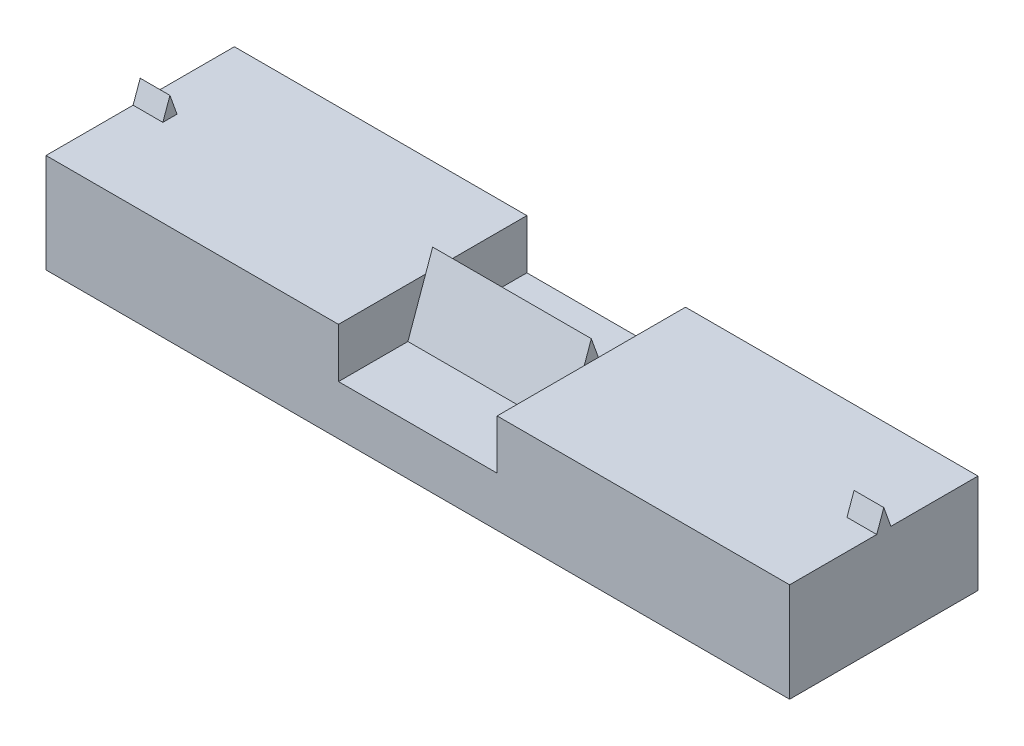
from build123d import *

# Parameters (mm, degrees)
SKETCH1_W                = 75
SKETCH1_H                = 19
BOSS_EXTRUDE1_DEPTH      = 10
SKETCH4_W                = 16
SKETCH4_H                = 19
CUT_EXTRUDE1_DEPTH       = 5
BOSS_EXTRUDE2_DEPTH      = 45.5
BOSS_EXTRUDE2_DEPTH_BACK = 29.5
SKETCH6_W                = 26.5
SKETCH6_H                = 19
CUT_EXTRUDE2_DEPTH       = 2


with BuildPart() as part:
    # Sketch1 → Boss-Extrude1 (new body)
    with BuildSketch(Plane(origin=(0, 0, 0), x_dir=(1, 0, 0), z_dir=(0, 1, 0))):
        Rectangle(SKETCH1_W, SKETCH1_H)
    extrude(amount=-BOSS_EXTRUDE1_DEPTH)

    # Sketch4 → Cut-Extrude1 (cut)
    with BuildSketch(Plane(origin=(0, 0, 0), x_dir=(1, 0, 0), z_dir=(0, 1, 0))):
        Rectangle(SKETCH4_W, SKETCH4_H)
    extrude(amount=-CUT_EXTRUDE1_DEPTH, mode=Mode.SUBTRACT)

    # Sketch5 → Boss-Extrude2 (add, two sides: drawn at the far end of the back side and taken through both)
    with BuildSketch(Plane.ZY.offset(-8).offset(-BOSS_EXTRUDE2_DEPTH_BACK)):
        Polygon((-2.5, -5), (0, 2), (2.5, -5), align=None)
    extrude(amount=BOSS_EXTRUDE2_DEPTH + BOSS_EXTRUDE2_DEPTH_BACK)

    # Sketch6 → Cut-Extrude2 (cut)
    with BuildSketch(Plane(origin=(0, 0, 0), x_dir=(1, 0, 0), z_dir=(0, 1, 0))):
        with Locations((-21.25, 0)):
            Rectangle(SKETCH6_W, SKETCH6_H)
        with Locations((21.25, 0)):
            Rectangle(SKETCH6_W, SKETCH6_H)
    extrude(amount=CUT_EXTRUDE2_DEPTH, mode=Mode.SUBTRACT)


solid = part.part
